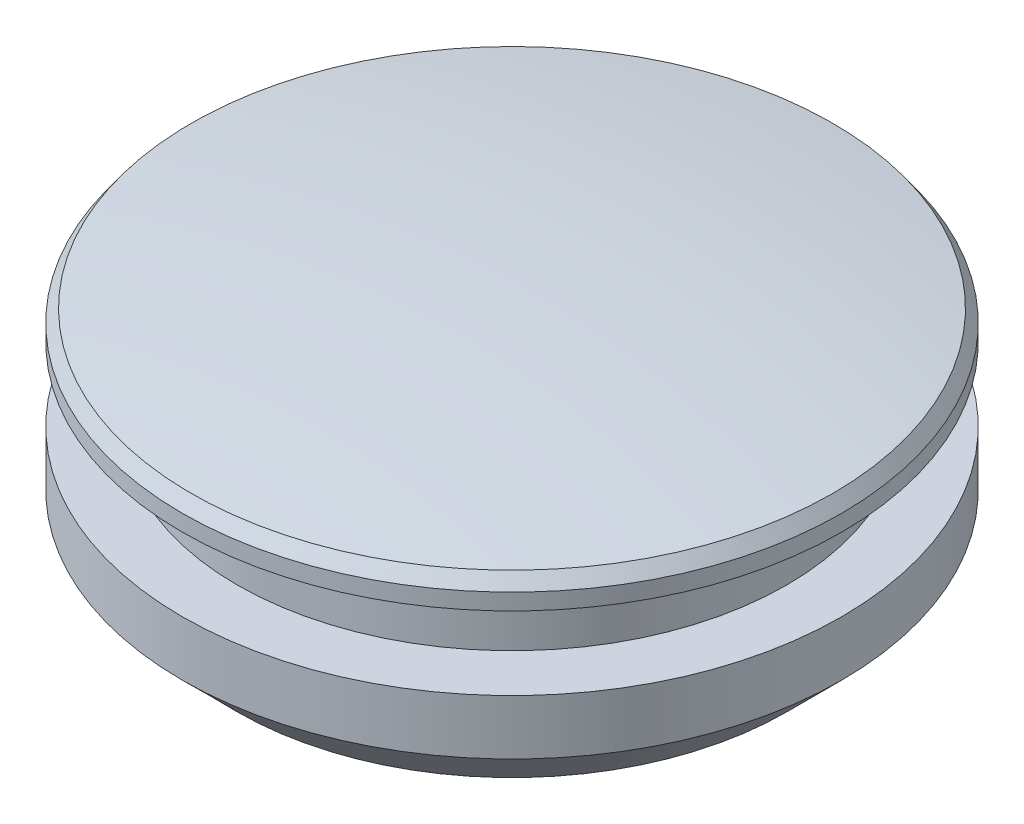
from build123d import *
from OCP.BRepFilletAPI import BRepFilletAPI_MakeChamfer

# Parameters (mm, degrees)
CHAMFER1_SIZE  = 0.25
CHAMFER1_SIZE2 = 0.304621849


with BuildPart() as part:
    # Sketch1 → Revolve1 (revolve)
    with BuildSketch(Plane.XY, mode=Mode.PRIVATE) as revolve1_sk:
        with BuildLine():
            Line((-6, 0), (-7.5, 0))
            Line((-7.5, 0), (-9, 1.5))
            Line((-9, 1.5), (-9, 3))
            Line((-9, 3), (-7.5, 3))
            Line((-7.5, 3), (-7.5, 5))
            Line((-7.5, 5), (-9, 5))
            Line((-9, 5), (-9, 5.75))
            ThreePointArc((-9, 5.75), (-4.515597967, 6.312175605), (0, 6.5))
            Line((0, 6.5), (0, 5))
            add(Edge.make_bspline(
                [(0, 5), (-6, 5), (-6, 3)],
                knots=[1.570796327, 1.570796327, 1.570796327, 3.141592654, 3.141592654, 3.141592654], degree=2, weights=[1, 0.707106781, 1]))
            Line((-6, 3), (-6, 0))
        make_face()
    revolve(revolve1_sk.sketch.rotate(Axis((0, -1000, 0), (0, 1, 0)), 180), axis=Axis((0, -1000, 0), (0, 1, 0)))

    # Chamfer1: one chamfer whose edges measure the first distance from different faces: ONE call of the kernel's chamfer builder (chamfer() names one face for all edges)
    chamfer1_edges_1 = [part.edges().sort_by_distance(p)[0] for p in [
        (-9, 5.75, 0),
    ]]
    chamfer1_side_1 = [part.faces().sort_by_distance(p)[0] for p in [
        (-4.515597967, 6.312175605, 0),
    ]]
    chamfer1_edges_2 = [part.edges().sort_by_distance(p)[0] for p in [
        (-6, 0, 0),
    ]]
    chamfer1 = BRepFilletAPI_MakeChamfer(part.part.solid().wrapped)
    for e in chamfer1_edges_1:
        chamfer1.Add(CHAMFER1_SIZE, CHAMFER1_SIZE2, e.wrapped, chamfer1_side_1[0].wrapped)  # the first distance lies on this face
    for e in chamfer1_edges_2:
        chamfer1.Add(CHAMFER1_SIZE, e.wrapped)
    add(Compound.cast(chamfer1.Shape()), mode=Mode.REPLACE)


solid = part.part
